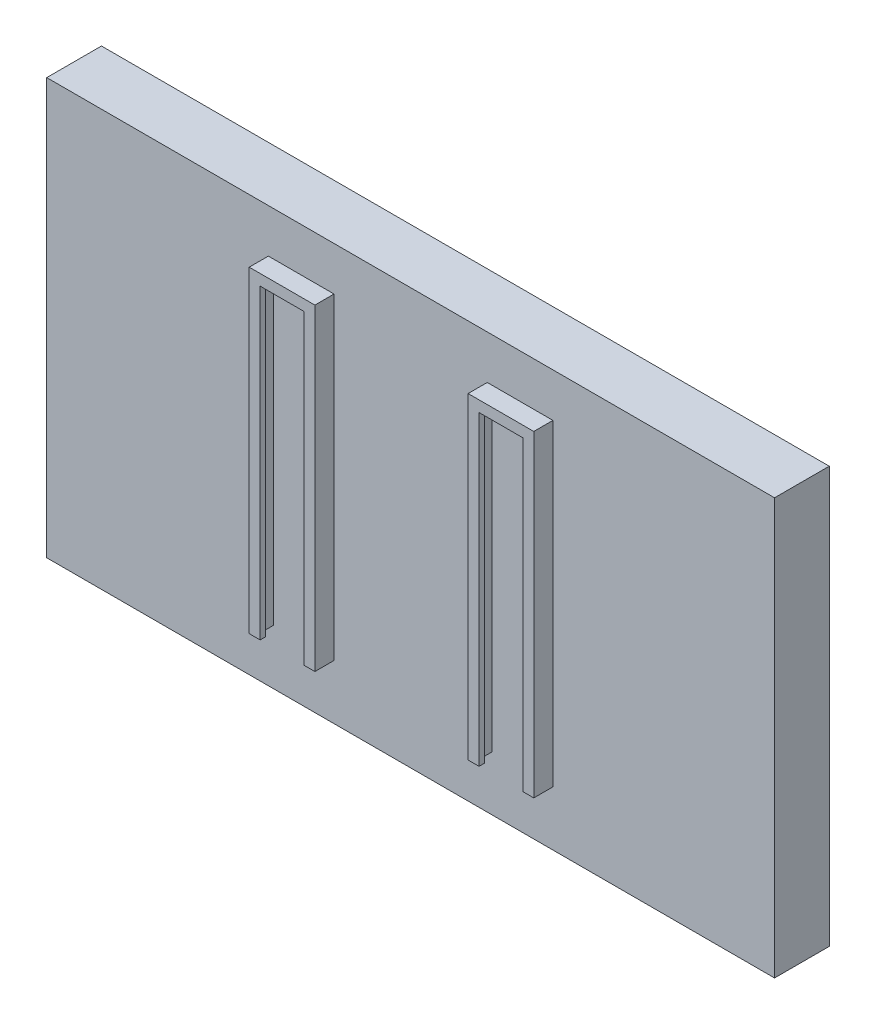
from build123d import *

# Parameters (mm, degrees)
CROQUIS1_W              = 133
CROQUIS1_H              = 76
SALIENTE_EXTRUIR1_DEPTH = 10
CROQUIS2_W              = 110
CROQUIS2_H              = 65
CORTAR_EXTRUIR1_DEPTH   = 2
CROQUIS3_W              = 2
CROQUIS3_H              = 56
SALIENTE_EXTRUIR6_DEPTH = 3.5
CROQUIS4_W              = 2.5
CROQUIS4_H              = 56
CORTAR_EXTRUIR2_DEPTH   = 1.1
CROQUIS5_W              = 2.5
CROQUIS5_H              = 56
CORTAR_EXTRUIR3_DEPTH   = 1.1
CROQUIS6_W              = 2.5
CROQUIS6_H              = 56
CORTAR_EXTRUIR4_DEPTH   = 1.1
CROQUIS7_W              = 2.5
CROQUIS7_H              = 56
CORTAR_EXTRUIR5_DEPTH   = 1.1


with BuildPart() as part:
    # Croquis1 → Saliente-Extruir1 (new body)
    with BuildSketch(Plane.XY):
        with Locations((0, 38)):
            Rectangle(CROQUIS1_W, CROQUIS1_H)
    extrude(amount=SALIENTE_EXTRUIR1_DEPTH)

    # Croquis2 → Cortar-Extruir1 (cut)
    with BuildSketch(Plane(origin=(0, 0, 0), x_dir=(-1, 0, 0), z_dir=(0, 0, -1))):
        with Locations((0, 38)):
            Rectangle(CROQUIS2_W, CROQUIS2_H)
    extrude(amount=-CORTAR_EXTRUIR1_DEPTH, mode=Mode.SUBTRACT)

    # Croquis3 → Saliente-Extruir6 (add)
    with BuildSketch(Plane.XY.offset(10)):
        Polygon((-26, 68), (-26, 66), (-24, 66), (-16, 66), (-14, 66), (-14, 68), align=None)
        with Locations((-25, 38)):
            Rectangle(CROQUIS3_W, CROQUIS3_H)
        with Locations((-15, 38)):
            Rectangle(CROQUIS3_W, CROQUIS3_H)
        with Locations((15, 38)):
            Rectangle(CROQUIS3_W, CROQUIS3_H)
        Polygon((14, 66), (16, 66), (24, 66), (26, 66), (26, 68), (14, 68), align=None)
        with Locations((25, 38)):
            Rectangle(CROQUIS3_W, CROQUIS3_H)
    extrude(amount=SALIENTE_EXTRUIR6_DEPTH)

    # Croquis4 → Cortar-Extruir2 (cut)
    with BuildSketch(Plane(origin=(-24, 0, 0), x_dir=(0, 0, -1), z_dir=(1, 0, 0))):
        with Locations((-11.25, 38)):
            Rectangle(CROQUIS4_W, CROQUIS4_H)
    extrude(amount=-CORTAR_EXTRUIR2_DEPTH, mode=Mode.SUBTRACT)

    # Croquis5 → Cortar-Extruir3 (cut)
    with BuildSketch(Plane.ZY.offset(16)):
        with Locations((11.25, 38)):
            Rectangle(CROQUIS5_W, CROQUIS5_H)
    extrude(amount=-CORTAR_EXTRUIR3_DEPTH, mode=Mode.SUBTRACT)

    # Croquis6 → Cortar-Extruir4 (cut)
    with BuildSketch(Plane(origin=(16, 0, 0), x_dir=(0, 0, -1), z_dir=(1, 0, 0))):
        with Locations((-11.25, 38)):
            Rectangle(CROQUIS6_W, CROQUIS6_H)
    extrude(amount=-CORTAR_EXTRUIR4_DEPTH, mode=Mode.SUBTRACT)

    # Croquis7 → Cortar-Extruir5 (cut)
    with BuildSketch(Plane.ZY.offset(-24)):
        with Locations((11.25, 38)):
            Rectangle(CROQUIS7_W, CROQUIS7_H)
    extrude(amount=-CORTAR_EXTRUIR5_DEPTH, mode=Mode.SUBTRACT)


solid = part.part
